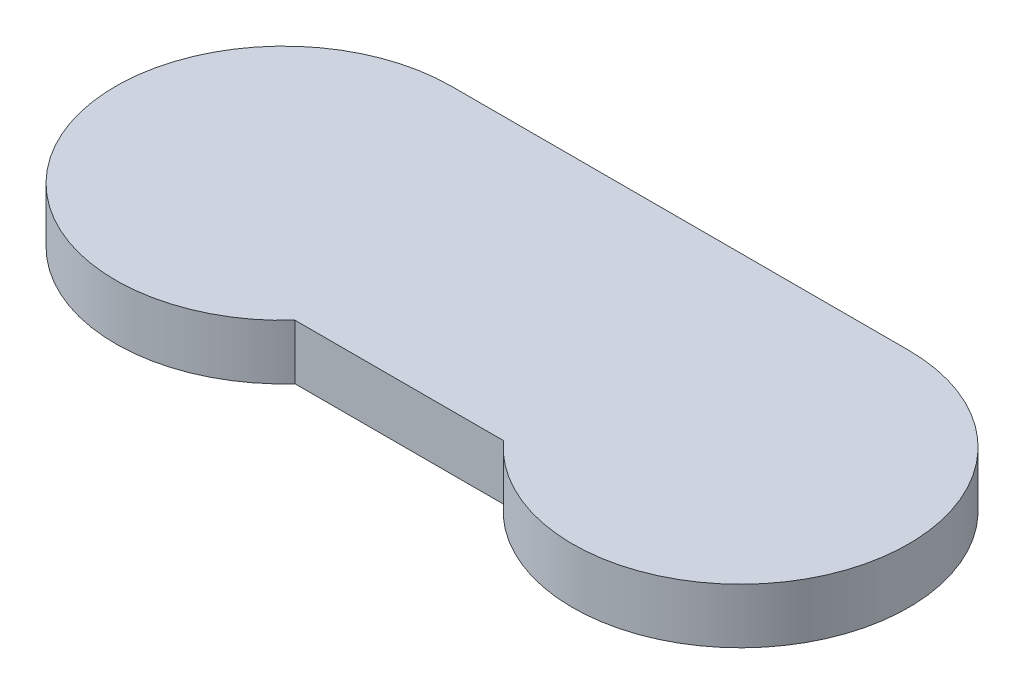
from build123d import *

# Parameters (mm, degrees)
BOSS_EXTRUDE1_DEPTH = 10
CUT_EXTRUDE1_DEPTH  = 5


with BuildPart() as part:
    # Sketch1 → Boss-Extrude1 (new body)
    with BuildSketch(Plane(origin=(0, 0, 0), x_dir=(1, 0, 0), z_dir=(0, 1, 0))):
        with BuildLine():
            Line((41.5, 30.5), (-41.5, 30.5))
            ThreePointArc((-41.5, 30.5), (-69.388169535, -12.349089035), (-18.916820419, -20.5))
            Line((-18.916820419, -20.5), (18.916820419, -20.5))
            ThreePointArc((18.916820419, -20.5), (69.388169535, -12.349089035), (41.5, 30.5))
        make_face()
    extrude(amount=BOSS_EXTRUDE1_DEPTH)

    # Sketch2 → Cut-Extrude1 (cut)
    with BuildSketch(Plane(origin=(0, 0, 0), x_dir=(1, 0, 0), z_dir=(0, 1, 0))):
        with BuildLine():
            Line((41.5, 25.5), (-41.5, 25.5))
            ThreePointArc((-41.5, 25.5), (-64.36372673, -11.291589791), (-21.251543269, -15.5))
            Line((-21.251543269, -15.5), (21.251543269, -15.5))
            ThreePointArc((21.251543269, -15.5), (64.36372673, -11.291589791), (41.5, 25.5))
        make_face()
    extrude(amount=CUT_EXTRUDE1_DEPTH, mode=Mode.SUBTRACT)


solid = part.part
